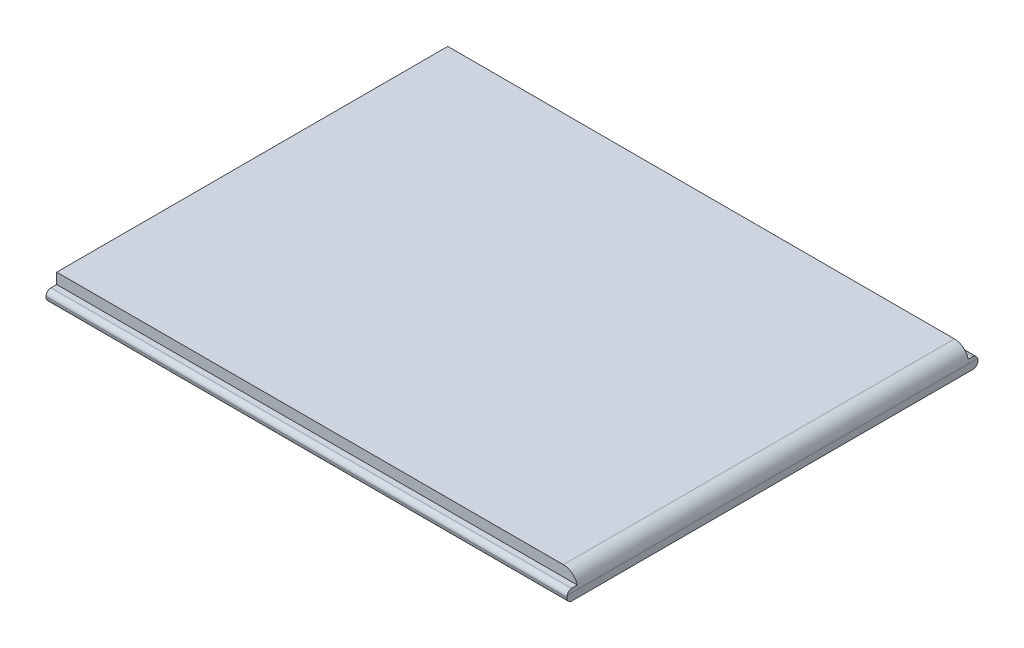
from build123d import *

# Parameters (mm, degrees)
CROQUIS1_W              = 73
CROQUIS1_H              = 57.6
SALIENTE_EXTRUIR1_DEPTH = 1.5
CROQUIS3_W              = 73
CROQUIS3_H              = 54.8
SALIENTE_EXTRUIR2_DEPTH = 3
REDONDEO1_R             = 2
REDONDEO4_R             = 0.7
REDONDEO5_R             = 0.7


with BuildPart() as part:
    # Croquis1 → Saliente-Extruir1 (new body)
    with BuildSketch(Plane(origin=(0, 0, 0), x_dir=(1, 0, 0), z_dir=(0, 1, 0))):
        with Locations((36.5, 28.8)):
            Rectangle(CROQUIS1_W, CROQUIS1_H)
    extrude(amount=SALIENTE_EXTRUIR1_DEPTH)

    # Croquis3 → Saliente-Extruir2 (add)
    with BuildSketch(Plane(origin=(0, 0, 0), x_dir=(1, 0, 0), z_dir=(0, 1, 0))):
        with Locations((36.5, 28.9)):
            Rectangle(CROQUIS3_W, CROQUIS3_H)
    extrude(amount=SALIENTE_EXTRUIR2_DEPTH)

    # Redondeo1
    redondeo1_edges = [part.edges().sort_by_distance(p)[0] for p in [
        (73, 3, -28.9),
    ]]
    fillet(redondeo1_edges, radius=REDONDEO1_R)

    # Redondeo4
    redondeo4_edges = [part.edges().sort_by_distance(p)[0] for p in [
        (36.5, 0, 0),
        (36.468245837, 1.5, 0),
    ]]
    fillet(redondeo4_edges, radius=REDONDEO4_R)

    # Redondeo5
    redondeo5_edges = [part.edges().sort_by_distance(p)[0] for p in [
        (36.5, 0, -57.6),
        (36.468245837, 1.5, -57.6),
    ]]
    fillet(redondeo5_edges, radius=REDONDEO5_R)


solid = part.part
